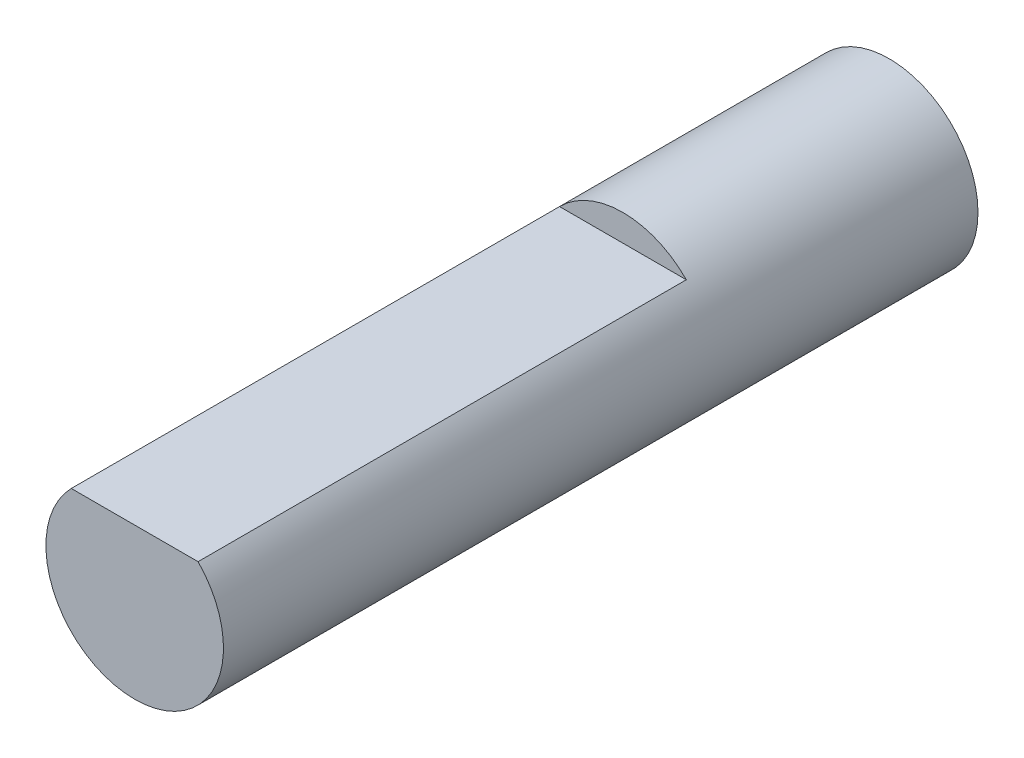
from build123d import *

# Parameters (mm, degrees)
CROQUIS1_R              = 2
SALIENTE_EXTRUIR1_DEPTH = 17
CORTAR_EXTRUIR1_START   = -11
CORTAR_EXTRUIR1_DEPTH   = 11


with BuildPart() as part:
    # Croquis1 → Saliente-Extruir1 (new body)
    with BuildSketch(Plane.XY):
        Circle(CROQUIS1_R)
    extrude(amount=SALIENTE_EXTRUIR1_DEPTH)

    # Croquis2 → Cortar-Extruir1 (cut)
    with BuildSketch(Plane.XY.offset(17).offset(CORTAR_EXTRUIR1_START)):
        with BuildLine():
            Line((-1.428285686, 1.4), (1.428285686, 1.4))
            ThreePointArc((1.428285686, 1.4), (0, 2), (-1.428285686, 1.4))
        make_face()
    extrude(amount=CORTAR_EXTRUIR1_DEPTH, mode=Mode.SUBTRACT)


solid = part.part
